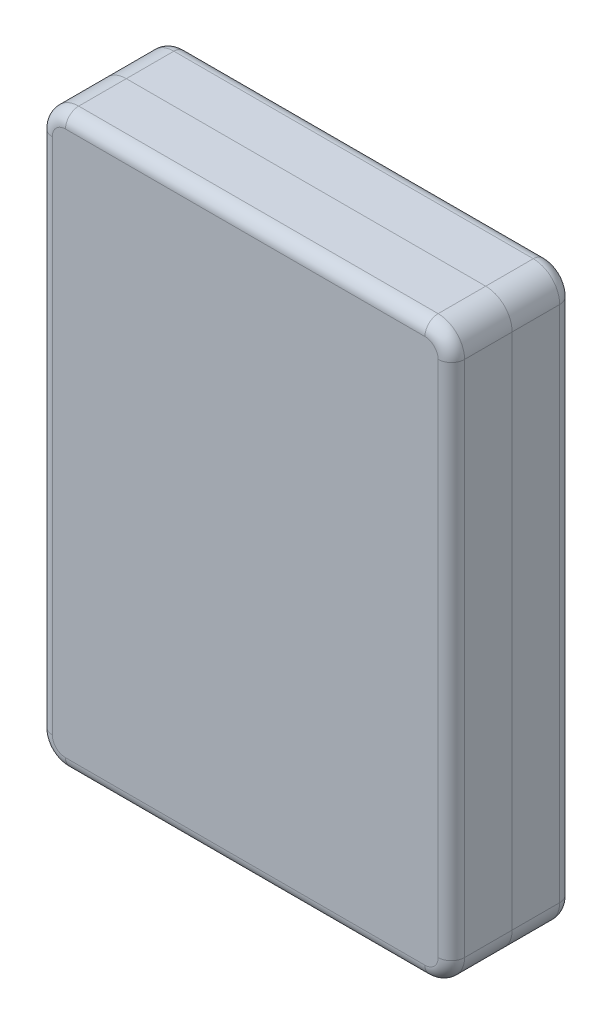
from build123d import *

# Parameters (mm, degrees)
SKETCH1_W              = 78
SKETCH1_H              = 108
MAIN_SHAPE_DEPTH       = 11.5
FILLET1_R              = 5
FILLET2_R              = 2.5
SHELL1_T               = 3
SPLIT1_SURFACE_1_BACK  = 136.192
SPLIT1_SURFACE_1_DEPTH = 272.384
SPLIT1_SURFACE_2_BACK  = 136.192
SPLIT1_SURFACE_2_DEPTH = 272.384


with BuildPart() as part:
    # Sketch1 → Main Shape (new, symmetric)
    with BuildSketch(Plane.XY):
        Rectangle(SKETCH1_W, SKETCH1_H)
    extrude(amount=MAIN_SHAPE_DEPTH, both=True)

    # Fillet1
    fillet1_edges = [part.edges().sort_by_distance(p)[0] for p in [
        (39, -54, 0),
        (-39, -54, 0),
        (-39, 54, 0),
        (39, 54, 0),
    ]]
    fillet(fillet1_edges, radius=FILLET1_R)

    # Fillet2
    fillet2_edges = [part.edges().sort_by_distance(p)[0] for p in [
        (39, 0, -11.5),
        (39, 0, 11.5),
        (0, -54, -11.5),
        (-39, 0, -11.5),
        (0, 54, -11.5),
        (37.535533906, 52.535533906, -11.5),
        (-37.535533906, 52.535533906, -11.5),
        (-37.535533906, -52.535533906, -11.5),
        (37.535533906, -52.535533906, -11.5),
        (0, -54, 11.5),
        (0, 54, 11.5),
        (-39, 0, 11.5),
        (37.535533906, 52.535533906, 11.5),
        (-37.535533906, 52.535533906, 11.5),
        (-37.535533906, -52.535533906, 11.5),
        (37.535533906, -52.535533906, 11.5),
    ]]
    fillet(fillet2_edges, radius=FILLET2_R)

    # Shell1 (no face opened: a closed hollow body)
    add(offset(amount=-SHELL1_T, mode=Mode.PRIVATE), mode=Mode.SUBTRACT)


with BuildPart() as body_2:
    # Split1: the piece behind the surface
    add(part.part)
    # Split1 surface: a surface, the sketch's curves swept straight by 272.384 mm
    with BuildLine(Plane(origin=(0, 0, 0), x_dir=(0, 0, -1), z_dir=(1, 0, 0)).offset(-SPLIT1_SURFACE_1_BACK), mode=Mode.PRIVATE) as split1_surface_1_path:
        Line((0, -65), (0, 65))
    split1_surface_1 = Shell.extrude(split1_surface_1_path.wire(), (1 * SPLIT1_SURFACE_1_DEPTH, 0 * SPLIT1_SURFACE_1_DEPTH, 0 * SPLIT1_SURFACE_1_DEPTH))
    split(bisect_by=split1_surface_1, keep=Keep.BOTTOM)


with BuildPart() as part_1:
    add(part.part)

    # Split1: split by a surface, the side it looks to stays
    # Split1 surface: a surface, the sketch's curves swept straight by 272.384 mm
    with BuildLine(Plane(origin=(0, 0, 0), x_dir=(0, 0, -1), z_dir=(1, 0, 0)).offset(-SPLIT1_SURFACE_2_BACK), mode=Mode.PRIVATE) as split1_surface_2_path:
        Line((0, -65), (0, 65))
    split1_surface_2 = Shell.extrude(split1_surface_2_path.wire(), (1 * SPLIT1_SURFACE_2_DEPTH, 0 * SPLIT1_SURFACE_2_DEPTH, 0 * SPLIT1_SURFACE_2_DEPTH))
    split(bisect_by=split1_surface_2, keep=Keep.TOP)


solid = Compound([body_2.part, part_1.part])
